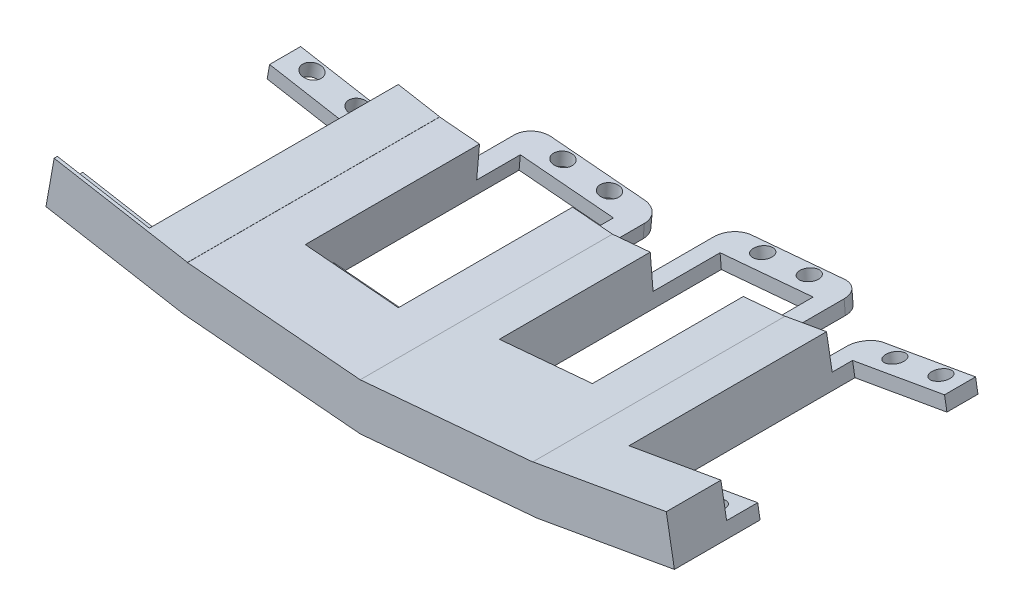
from build123d import *

# Parameters (mm, degrees)
SKETCH10_W               = 70
SKETCH10_H               = 38
BOSS_EXTRUDE6_DEPTH      = 10
SKETCH11_W               = 75
SKETCH11_H               = 38
BOSS_EXTRUDE7_DEPTH      = 10
SKETCH12_W               = 54
SKETCH12_H               = 29
BOSS_EXTRUDE8_DEPTH      = 10
SKETCH13_W               = 65
SKETCH13_H               = 29
BOSS_EXTRUDE9_DEPTH      = 10
SKETCH14_R               = 2
PINKY_HOLE_EXTRUDE_DEPTH = 10
SKETCH14_3_W             = 10
SKETCH14_3_H             = 6.65
SKETCH14_3_R             = 2
SKETCH14_3_W_2           = 20
CUT_EXTRUDE12_DEPTH      = 7
SKETCH16_W               = 10
SKETCH16_H               = 6.65
SKETCH16_R               = 2
RING_HOLE_EXTRUDE_DEPTH  = 7
SKETCH16_3_R             = 2
CUT_EXTRUDE14_DEPTH      = 10
SKETCH17_R               = 2
CUT_EXTRUDE15_DEPTH      = 10
SKETCH18_R               = 2
CUT_EXTRUDE16_DEPTH      = 10
SKETCH18_3_W             = 20
SKETCH18_3_H             = 6.65
SKETCH18_3_R             = 2
CUT_EXTRUDE17_DEPTH      = 7
SKETCH17_3_W             = 20
SKETCH17_3_H             = 6.65
SKETCH17_3_R             = 2
CUT_EXTRUDE18_DEPTH      = 7
CUT_EXTRUDE19_START      = -10
CUT_EXTRUDE19_DEPTH      = 10
CUT_EXTRUDE20_START      = -10
CUT_EXTRUDE20_DEPTH      = 12.565425
CUT_EXTRUDE21_START      = -10
CUT_EXTRUDE21_DEPTH      = 10
SKETCH21_W               = 8.817625364
SKETCH21_H               = 29.329056716
CUT_EXTRUDE22_DEPTH      = 10.038198
BOSS_EXTRUDE10_DEPTH     = 54
SKETCH25_W               = 6.65
SKETCH25_H               = 3
BOSS_EXTRUDE12_DEPTH     = 4
SKETCH26_W               = 6.65
SKETCH26_H               = 3
BOSS_EXTRUDE13_DEPTH     = 4
SKETCH27_W               = 6.65
SKETCH27_H               = 3
BOSS_EXTRUDE14_DEPTH     = 4
SKETCH28_W               = 6.65
SKETCH28_H               = 3
BOSS_EXTRUDE15_DEPTH     = 4
SKETCH29_W               = 6.65
SKETCH29_H               = 3
BOSS_EXTRUDE16_DEPTH     = 4
BOSS_EXTRUDE17_REACH     = 92.923
BOSS_EXTRUDE18_REACH     = 99.642
BOSS_EXTRUDE19_REACH     = 96.21
FILLET1_R                = 4


with BuildPart() as part:
    # Sketch10 → Boss-Extrude6 (new body)
    with BuildSketch(Plane(origin=(0, 0, 0), x_dir=(0, 0, -1), z_dir=(0.08715574274765835, 0.9961946980917455, 0))):
        with Locations((35, 19)):
            Rectangle(SKETCH10_W, SKETCH10_H)
    extrude(amount=BOSS_EXTRUDE6_DEPTH)

    # Sketch11 → Boss-Extrude7 (add)
    with BuildSketch(Plane(origin=(0, 0, 0), x_dir=(0, 0, -1), z_dir=(-0.08715574274765835, 0.9961946980917455, 0))):
        with Locations((37.5, -19)):
            Rectangle(SKETCH11_W, SKETCH11_H)
    extrude(amount=BOSS_EXTRUDE7_DEPTH)

    # Sketch16 → Ring Hole Extrude (cut)
    # profile 1 of 6: a face of its own
    with BuildSketch(Plane(origin=(0.871557427, 9.961946981, 0), x_dir=(0.9961946980917457, -0.08715574274765836, 0), z_dir=(0.08715574274765836, 0.9961946980917457, 0))):
        with BuildLine():
            Line((-19.437443318, 63.35), (-19.437443318, 70))
            Line((-19.437443318, 70), (-24.437443318, 70))
            Line((-24.437443318, 70), (-24.437443318, 69.5))
            ThreePointArc((-24.437443318, 69.5), (-23.023229755, 68.914213562), (-22.437443318, 67.5))
            ThreePointArc((-22.437443318, 67.5), (-24.437443318, 65.5), (-26.437443318, 67.5))
            Line((-26.437443318, 67.5), (-29.437443318, 67.5))
            Line((-29.437443318, 67.5), (-29.437443318, 63.35))
            Line((-29.437443318, 63.35), (-19.437443318, 63.35))
        make_face()
    # profile 2 of 6: a face of its own
    with BuildSketch(Plane(origin=(0.871557427, 9.961946981, 0), x_dir=(0.9961946980917457, -0.08715574274765836, 0), z_dir=(0.08715574274765836, 0.9961946980917457, 0))):
        with BuildLine():
            Line((-24.437443318, 69.5), (-24.437443318, 70))
            Line((-24.437443318, 70), (-29.437443318, 70))
            Line((-29.437443318, 70), (-29.437443318, 67.5))
            Line((-29.437443318, 67.5), (-26.437443318, 67.5))
            ThreePointArc((-26.437443318, 67.5), (-25.85165688, 68.914213562), (-24.437443318, 69.5))
        make_face()
    # profile 3 of 6: a face of its own
    with BuildSketch(Plane(origin=(0.871557427, 9.961946981, 0), x_dir=(0.9961946980917457, -0.08715574274765836, 0), z_dir=(0.08715574274765836, 0.9961946980917457, 0))):
        with BuildLine():
            Line((-14.437443318, 69.5), (-14.437443318, 70))
            Line((-14.437443318, 70), (-19.437443318, 70))
            Line((-19.437443318, 70), (-19.437443318, 63.35))
            Line((-19.437443318, 63.35), (-9.437443318, 63.35))
            Line((-9.437443318, 63.35), (-9.437443318, 67.5))
            Line((-9.437443318, 67.5), (-12.437443318, 67.5))
            ThreePointArc((-12.437443318, 67.5), (-15.85165688, 66.085786438), (-14.437443318, 69.5))
        make_face()
    # profile 4 of 6: a face of its own
    with BuildSketch(Plane(origin=(0.871557427, 9.961946981, 0), x_dir=(0.9961946980917457, -0.08715574274765836, 0), z_dir=(0.08715574274765836, 0.9961946980917457, 0))):
        with BuildLine():
            Line((-9.437443318, 67.5), (-9.437443318, 70))
            Line((-9.437443318, 70), (-14.437443318, 70))
            Line((-14.437443318, 70), (-14.437443318, 69.5))
            ThreePointArc((-14.437443318, 69.5), (-13.023229755, 68.914213562), (-12.437443318, 67.5))
            Line((-12.437443318, 67.5), (-9.437443318, 67.5))
        make_face()
    # profile 5 of 6: a face of its own
    with BuildSketch(Plane(origin=(0.871557427, 9.961946981, 0), x_dir=(0.9961946980917457, -0.08715574274765836, 0), z_dir=(0.08715574274765836, 0.9961946980917457, 0))):
        with Locations((-14.437443318, 20.025)):
            Rectangle(SKETCH16_W, SKETCH16_H)
        with Locations(Location((-14.437443318, 19.2, 0), (0, 0, 180))):
            Circle(SKETCH16_R, mode=Mode.SUBTRACT)
    # profile 6 of 6: a face of its own
    with BuildSketch(Plane(origin=(0.871557427, 9.961946981, 0), x_dir=(0.9961946980917457, -0.08715574274765836, 0), z_dir=(0.08715574274765836, 0.9961946980917457, 0))):
        with Locations((-24.437443318, 20.025)):
            Rectangle(SKETCH16_W, SKETCH16_H)
        with Locations(Location((-24.437443318, 19.2, 0), (0, 0, 180))):
            Circle(SKETCH16_R, mode=Mode.SUBTRACT)
    extrude(amount=-RING_HOLE_EXTRUDE_DEPTH, mode=Mode.SUBTRACT)

    # Sketch16<3> → Cut-Extrude14 (cut)
    with BuildSketch(Plane(origin=(0.871557427, 9.961946981, 0), x_dir=(0.9961946980917457, -0.08715574274765836, 0), z_dir=(0.08715574274765836, 0.9961946980917457, 0))):
        with BuildLine():
            ThreePointArc((-22.437443318, 67.5), (-23.023229755, 68.914213562), (-24.437443318, 69.5))
            Line((-24.437443318, 69.5), (-24.437443318, 67.5))
            Line((-24.437443318, 67.5), (-26.437443318, 67.5))
            ThreePointArc((-26.437443318, 67.5), (-24.437443318, 65.5), (-22.437443318, 67.5))
        make_face()
        with BuildLine():
            Line((-24.437443318, 67.5), (-24.437443318, 69.5))
            ThreePointArc((-24.437443318, 69.5), (-25.85165688, 68.914213562), (-26.437443318, 67.5))
            Line((-26.437443318, 67.5), (-24.437443318, 67.5))
        make_face()
        with BuildLine():
            ThreePointArc((-12.437443318, 67.5), (-13.023229755, 68.914213562), (-14.437443318, 69.5))
            Line((-14.437443318, 69.5), (-14.437443318, 67.5))
            Line((-14.437443318, 67.5), (-12.437443318, 67.5))
        make_face()
        with BuildLine():
            Line((-14.437443318, 67.5), (-14.437443318, 69.5))
            ThreePointArc((-14.437443318, 69.5), (-15.85165688, 66.085786438), (-12.437443318, 67.5))
            Line((-12.437443318, 67.5), (-14.437443318, 67.5))
        make_face()
        with Locations(Location((-24.437443318, 19.2, 0), (0, 0, 180))):
            Circle(SKETCH16_3_R)
        with Locations(Location((-14.437443318, 19.2, 0), (0, 0, 180))):
            Circle(SKETCH16_3_R)
        Polygon((-16.032346576, 43.35), (-19.437443318, 43.35), (-19.437443318, 23.35), (-9.437443318, 23.35), (-9.437443318, 43.35), align=None)
        Polygon((-19.437443318, 23.35), (-19.437443318, 43.35), (-22.842540059, 43.35), (-29.437443318, 43.35), (-29.437443318, 23.35), align=None)
        Polygon((-9.437443318, 54), (-9.437443318, 63.35), (-19.437443318, 63.35), (-19.437443318, 43.35), (-16.032346576, 43.35), (-9.437443318, 43.35), align=None)
        Polygon((-19.437443318, 43.35), (-19.437443318, 63.35), (-29.437443318, 63.35), (-29.437443318, 54), (-29.437443318, 43.35), (-22.842540059, 43.35), align=None)
    extrude(amount=-CUT_EXTRUDE14_DEPTH, mode=Mode.SUBTRACT)

    # Sketch17 → Cut-Extrude15 (cut)
    with BuildSketch(Plane(origin=(-0.871557427, 9.961946981, 0), x_dir=(0.9961946980917457, 0.08715574274765836, 0), z_dir=(-0.08715574274765836, 0.9961946980917457, 0))):
        with BuildLine():
            ThreePointArc((16, 72.5), (15.414213562, 73.914213562), (14, 74.5))
            Line((14, 74.5), (14, 72.5))
            Line((14, 72.5), (12, 72.5))
            ThreePointArc((12, 72.5), (14, 70.5), (16, 72.5))
        make_face()
        with BuildLine():
            Line((14, 72.5), (14, 74.5))
            ThreePointArc((14, 74.5), (12.585786438, 73.914213562), (12, 72.5))
            Line((12, 72.5), (14, 72.5))
        make_face()
        with BuildLine():
            ThreePointArc((26, 72.5), (25.414213562, 73.914213562), (24, 74.5))
            Line((24, 74.5), (24, 72.5))
            Line((24, 72.5), (26, 72.5))
        make_face()
        with BuildLine():
            Line((24, 72.5), (24, 74.5))
            ThreePointArc((24, 74.5), (22.585786438, 71.085786438), (26, 72.5))
            Line((26, 72.5), (24, 72.5))
        make_face()
        with Locations(Location((14, 24.2, 0), (0, 0, 180))):
            Circle(SKETCH17_R)
        with Locations(Location((24, 24.2, 0), (0, 0, 180))):
            Circle(SKETCH17_R)
        Polygon((19, 28.35), (19, 48.35), (15.594903258, 48.35), (9, 48.35), (9, 28.35), align=None)
        Polygon((22.405096742, 48.35), (19, 48.35), (19, 28.35), (29, 28.35), (29, 48.35), align=None)
        Polygon((29, 54), (29, 68.35), (19, 68.35), (19, 48.35), (22.405096742, 48.35), (29, 48.35), align=None)
        Polygon((19, 48.35), (19, 68.35), (9, 68.35), (9, 54), (9, 48.35), (15.594903258, 48.35), align=None)
    extrude(amount=-CUT_EXTRUDE15_DEPTH, mode=Mode.SUBTRACT)

    # Sketch17<3> → Cut-Extrude18 (cut)
    # profile 1 of 2: a face of its own
    with BuildSketch(Plane(origin=(-0.871557427, 9.961946981, 0), x_dir=(0.9961946980917457, 0.08715574274765836, 0), z_dir=(-0.08715574274765836, 0.9961946980917457, 0))):
        with Locations((19, 71.675)):
            Rectangle(SKETCH17_3_W, SKETCH17_3_H)
        with Locations((14, 72.5)):
            Circle(SKETCH17_3_R, mode=Mode.SUBTRACT)
        with Locations((24, 72.5)):
            Circle(SKETCH17_3_R, mode=Mode.SUBTRACT)
    # profile 2 of 2: a face of its own
    with BuildSketch(Plane(origin=(-0.871557427, 9.961946981, 0), x_dir=(0.9961946980917457, 0.08715574274765836, 0), z_dir=(-0.08715574274765836, 0.9961946980917457, 0))):
        with Locations((19, 25.025)):
            Rectangle(SKETCH17_3_W, SKETCH17_3_H)
        with Locations((24, 24.2)):
            Circle(SKETCH17_3_R, mode=Mode.SUBTRACT)
        with Locations((14, 24.2)):
            Circle(SKETCH17_3_R, mode=Mode.SUBTRACT)
    extrude(amount=-CUT_EXTRUDE18_DEPTH, mode=Mode.SUBTRACT)

    # Sketch16<4> → Cut-Extrude19 (cut)
    with BuildSketch(Plane(origin=(0.871557427, 9.961946981, 0), x_dir=(0.9961946980917457, -0.08715574274765836, 0), z_dir=(0.08715574274765836, 0.9961946980917457, 0)).offset(CUT_EXTRUDE19_START)):
        Polygon((-29.437443318, 67.5), (-29.437443318, 70), (-38, 70), (-38, 54), (-29.437443318, 54), (-29.437443318, 63.35), align=None)
        Polygon((-0.874886635, 70), (-9.437443318, 70), (-9.437443318, 67.5), (-9.437443318, 63.35), (-9.437443318, 54), (-0.874886635, 54), align=None)
    extrude(amount=CUT_EXTRUDE19_DEPTH, mode=Mode.SUBTRACT)


with BuildPart() as body_2:
    # Sketch12 → Boss-Extrude8 (new body)
    with BuildSketch(Plane(origin=(-0.575108564, -3.261602745, 0), x_dir=(0, 0, 1), z_dir=(0.1736481776669307, 0.984807753012208, 0))):
        with Locations((-27, -53.226955955)):
            Rectangle(SKETCH12_W, SKETCH12_H)
    extrude(amount=BOSS_EXTRUDE8_DEPTH)

    # Sketch14 → Pinky Hole Extrude (cut)
    with BuildSketch(Plane(origin=(1.161373212, 6.586474785, 0), x_dir=(0.9848077530122081, -0.17364817766693064, 0), z_dir=(0.17364817766693064, 0.9848077530122081, 0))):
        Polygon((-47.726955955, 47.35), (-57.726955955, 47.35), (-67.726955955, 47.35), (-67.726955955, 7.35), (-47.726955955, 7.35), align=None)
        with Locations(Location((-62.726955955, 51.5, 0), (0, 0, 180))):
            Circle(SKETCH14_R)
        with Locations(Location((-52.726955955, 51.5, 0), (0, 0, 180))):
            Circle(SKETCH14_R)
        with Locations(Location((-52.726955955, 3.2, 0), (0, 0, 180))):
            Circle(SKETCH14_R)
        with Locations(Location((-62.726955955, 3.2, 0), (0, 0, 180))):
            Circle(SKETCH14_R)
    extrude(amount=-PINKY_HOLE_EXTRUDE_DEPTH, mode=Mode.SUBTRACT)

    # Sketch14<3> → Cut-Extrude12 (cut)
    # profile 1 of 4: a face of its own
    with BuildSketch(Plane(origin=(1.161373212, 6.586474785, 0), x_dir=(0.9848077530122081, -0.17364817766693064, 0), z_dir=(0.17364817766693064, 0.9848077530122081, 0))):
        with BuildLine():
            Line((-57.726955955, 47.35), (-57.726955955, 54))
            Line((-57.726955955, 54), (-62.726955955, 54))
            Line((-62.726955955, 54), (-62.726955955, 53.5))
            ThreePointArc((-62.726955955, 53.5), (-61.312742393, 52.914213562), (-60.726955955, 51.5))
            ThreePointArc((-60.726955955, 51.5), (-62.726955955, 49.5), (-64.726955955, 51.5))
            Line((-64.726955955, 51.5), (-67.726955955, 51.5))
            Line((-67.726955955, 51.5), (-67.726955955, 47.35))
            Line((-67.726955955, 47.35), (-57.726955955, 47.35))
        make_face()
    # profile 2 of 4: a face of its own
    with BuildSketch(Plane(origin=(1.161373212, 6.586474785, 0), x_dir=(0.9848077530122081, -0.17364817766693064, 0), z_dir=(0.17364817766693064, 0.9848077530122081, 0))):
        with BuildLine():
            Line((-62.726955955, 53.5), (-62.726955955, 54))
            Line((-62.726955955, 54), (-67.726955955, 54))
            Line((-67.726955955, 54), (-67.726955955, 51.5))
            Line((-67.726955955, 51.5), (-64.726955955, 51.5))
            ThreePointArc((-64.726955955, 51.5), (-64.141169517, 52.914213562), (-62.726955955, 53.5))
        make_face()
    # profile 3 of 4: a face of its own
    with BuildSketch(Plane(origin=(1.161373212, 6.586474785, 0), x_dir=(0.9848077530122081, -0.17364817766693064, 0), z_dir=(0.17364817766693064, 0.9848077530122081, 0))):
        with Locations((-52.726955955, 50.675)):
            Rectangle(SKETCH14_3_W, SKETCH14_3_H)
        with Locations(Location((-52.726955955, 51.5, 0), (0, 0, 180))):
            Circle(SKETCH14_3_R, mode=Mode.SUBTRACT)
    # profile 4 of 4: a face of its own
    with BuildSketch(Plane(origin=(1.161373212, 6.586474785, 0), x_dir=(0.9848077530122081, -0.17364817766693064, 0), z_dir=(0.17364817766693064, 0.9848077530122081, 0))):
        with Locations((-57.726955955, 4.025)):
            Rectangle(SKETCH14_3_W_2, SKETCH14_3_H)
        with Locations(Location((-62.726955955, 3.2, 0), (0, 0, 180))):
            Circle(SKETCH14_3_R, mode=Mode.SUBTRACT)
        with Locations(Location((-52.726955955, 3.2, 0), (0, 0, 180))):
            Circle(SKETCH14_3_R, mode=Mode.SUBTRACT)
    extrude(amount=-CUT_EXTRUDE12_DEPTH, mode=Mode.SUBTRACT)



with BuildPart() as body_3:
    # Sketch13 → Boss-Extrude9 (new body)
    with BuildSketch(Plane(origin=(0.575108564, -3.261602745, 0), x_dir=(0, 0, -1), z_dir=(-0.1736481776669307, 0.984807753012208, 0))):
        with Locations((32.5, -53.226955955)):
            Rectangle(SKETCH13_W, SKETCH13_H)
    extrude(amount=BOSS_EXTRUDE9_DEPTH)

    # Sketch18 → Cut-Extrude16 (cut)
    with BuildSketch(Plane(origin=(-1.161373212, 6.586474785, 0), x_dir=(0.984807753012208, 0.17364817766693064, 0), z_dir=(-0.17364817766693064, 0.984807753012208, 0))):
        with BuildLine():
            ThreePointArc((54.726955955, 62.5), (54.141169517, 63.914213562), (52.726955955, 64.5))
            Line((52.726955955, 64.5), (52.726955955, 62.5))
            Line((52.726955955, 62.5), (50.726955955, 62.5))
            ThreePointArc((50.726955955, 62.5), (52.726955955, 60.5), (54.726955955, 62.5))
        make_face()
        with BuildLine():
            Line((52.726955955, 62.5), (52.726955955, 64.5))
            ThreePointArc((52.726955955, 64.5), (51.312742393, 63.914213562), (50.726955955, 62.5))
            Line((50.726955955, 62.5), (52.726955955, 62.5))
        make_face()
        with BuildLine():
            ThreePointArc((64.726955955, 62.5), (64.141169517, 63.914213562), (62.726955955, 64.5))
            Line((62.726955955, 64.5), (62.726955955, 62.5))
            Line((62.726955955, 62.5), (64.726955955, 62.5))
        make_face()
        with BuildLine():
            Line((62.726955955, 62.5), (62.726955955, 64.5))
            ThreePointArc((62.726955955, 64.5), (61.312742393, 61.085786438), (64.726955955, 62.5))
            Line((64.726955955, 62.5), (62.726955955, 62.5))
        make_face()
        with Locations(Location((62.726955955, 14.2, 0), (0, 0, 180))):
            Circle(SKETCH18_R)
        with Locations(Location((52.726955955, 14.2, 0), (0, 0, 180))):
            Circle(SKETCH18_R)
        Polygon((67.726955955, 38.35), (67.726955955, 58.35), (57.726955955, 58.35), (57.726955955, 38.35), (61.132052697, 38.35), align=None)
        Polygon((57.726955955, 38.35), (57.726955955, 58.35), (47.726955955, 58.35), (47.726955955, 54), (47.726955955, 38.35), (54.321859213, 38.35), align=None)
        Polygon((57.726955955, 18.35), (57.726955955, 38.35), (54.321859213, 38.35), (47.726955955, 38.35), (47.726955955, 18.35), align=None)
        Polygon((67.726955955, 18.35), (67.726955955, 38.35), (61.132052697, 38.35), (57.726955955, 38.35), (57.726955955, 18.35), align=None)
    extrude(amount=-CUT_EXTRUDE16_DEPTH, mode=Mode.SUBTRACT)

    # Sketch18<3> → Cut-Extrude17 (cut)
    # profile 1 of 2: a face of its own
    with BuildSketch(Plane(origin=(-1.161373212, 6.586474785, 0), x_dir=(0.984807753012208, 0.17364817766693064, 0), z_dir=(-0.17364817766693064, 0.984807753012208, 0))):
        with Locations((57.726955955, 61.675)):
            Rectangle(SKETCH18_3_W, SKETCH18_3_H)
        with Locations((52.726955955, 62.5)):
            Circle(SKETCH18_3_R, mode=Mode.SUBTRACT)
        with Locations((62.726955955, 62.5)):
            Circle(SKETCH18_3_R, mode=Mode.SUBTRACT)
    # profile 2 of 2: a face of its own
    with BuildSketch(Plane(origin=(-1.161373212, 6.586474785, 0), x_dir=(0.984807753012208, 0.17364817766693064, 0), z_dir=(-0.17364817766693064, 0.984807753012208, 0))):
        with Locations((57.726955955, 15.025)):
            Rectangle(SKETCH18_3_W, SKETCH18_3_H)
        with Locations((62.726955955, 14.2)):
            Circle(SKETCH18_3_R, mode=Mode.SUBTRACT)
        with Locations((52.726955955, 14.2)):
            Circle(SKETCH18_3_R, mode=Mode.SUBTRACT)
    extrude(amount=-CUT_EXTRUDE17_DEPTH, mode=Mode.SUBTRACT)

    # Sketch18<4> → Cut-Extrude21 (cut)
    with BuildSketch(Plane(origin=(-1.161373212, 6.586474785, 0), x_dir=(0.984807753012208, 0.17364817766693064, 0), z_dir=(-0.17364817766693064, 0.984807753012208, 0)).offset(CUT_EXTRUDE21_START)):
        Polygon((47.726955955, 62.5), (47.726955955, 65), (38.726955955, 65), (38.726955955, 54), (47.726955955, 54), (47.726955955, 58.35), align=None)
    extrude(amount=CUT_EXTRUDE21_DEPTH, mode=Mode.SUBTRACT)


with BuildPart() as cut_extrude19_piece_1:
    # of the separate pieces the step leaves, piece 1, a body of its own (cut_extrude19_pieces)
    add(part.part.solids().sort_by_distance((37.855398527, 3.311918224, 0))[0])

    # Sketch17<4> → Cut-Extrude20 (cut)
    with BuildSketch(Plane(origin=(-0.871557427, 9.961946981, 0), x_dir=(0.9961946980917457, 0.08715574274765836, 0), z_dir=(-0.08715574274765836, 0.9961946980917457, 0)).offset(CUT_EXTRUDE20_START)):
        Polygon((9, 72.5), (9, 75), (0, 75), (0, 70), (0.874886635, 70), (0.874886635, 54), (9, 54), (9, 68.35), align=None)
        Polygon((38, 75), (29, 75), (29, 72.5), (29, 68.35), (29, 54), (38, 54), align=None)
    extrude(amount=CUT_EXTRUDE20_DEPTH, mode=Mode.SUBTRACT)


with BuildPart() as cut_extrude19_piece_2:
    # of the separate pieces the step leaves, piece 2, a body of its own (cut_extrude19_pieces)
    add(part.part.solids().sort_by_distance((-9.401530997, 0.822527382, -70))[0])

    # Sketch28 → Boss-Extrude15 (add)
    with BuildSketch(Plane(origin=(-9.401530997, 0.822527382, 0), x_dir=(0, 0, -1), z_dir=(0.9961946980917457, -0.08715574274765837, 2.8254721722816123e-15))):
        with Locations((66.675, 1.5)):
            Rectangle(SKETCH28_W, SKETCH28_H)
    extrude(amount=BOSS_EXTRUDE15_DEPTH)

    # Sketch29 → Boss-Extrude16 (add)
    with BuildSketch(Plane(origin=(-29.325424958, 2.565642237, 0), x_dir=(0, 0, 1), z_dir=(-0.9961946980917457, 0.08715574274765837, 0))):
        with Locations((-66.675, 1.5)):
            Rectangle(SKETCH29_W, SKETCH29_H)
    extrude(amount=BOSS_EXTRUDE16_DEPTH)


with BuildPart() as cut_extrude20_piece_1:
    # of the separate pieces the step leaves, piece 1, a body of its own (cut_extrude20_pieces)
    add(cut_extrude19_piece_1.part.solids().sort_by_distance((37.855398527, 3.311918224, 0))[0])

    # Sketch21 → Cut-Extrude22 (cut)
    with BuildSketch(Plane(origin=(0, 0, 0), x_dir=(1, 0, 0), z_dir=(0, 1, 0))):
        with Locations((0.143825897, 68.664528358)):
            Rectangle(SKETCH21_W, SKETCH21_H)
    extrude(amount=CUT_EXTRUDE22_DEPTH, mode=Mode.SUBTRACT)


with BuildPart() as cut_extrude20_piece_2:
    # of the separate pieces the step leaves, piece 2, a body of its own (cut_extrude20_pieces)
    add(cut_extrude19_piece_1.part.solids().sort_by_distance((8.965752283, 0.784401685, -68.35))[0])

    # Sketch26 → Boss-Extrude13 (add)
    with BuildSketch(Plane(origin=(28.889646245, 2.52751654, 0), x_dir=(0, 0, -1), z_dir=(0.9961946980917457, 0.08715574274765836, 0))):
        with Locations((71.675, 1.5)):
            Rectangle(SKETCH26_W, SKETCH26_H)
    extrude(amount=BOSS_EXTRUDE13_DEPTH)

    # Sketch27 → Boss-Extrude14 (add)
    with BuildSketch(Plane(origin=(8.965752283, 0.784401685, 0), x_dir=(0, 0, 1), z_dir=(-0.9961946980917457, -0.08715574274765836, 0))):
        with Locations((-71.675, 1.5)):
            Rectangle(SKETCH27_W, SKETCH27_H)
    extrude(amount=BOSS_EXTRUDE14_DEPTH)


with BuildPart() as cut_extrude21_piece_1:
    # of the separate pieces the step leaves, piece 1, a body of its own (cut_extrude21_pieces)
    add(body_3.part.solids().sort_by_distance((67.273139877, 8.499059736, 0))[0])


with BuildPart() as cut_extrude21_piece_2:
    # of the separate pieces the step leaves, piece 2, a body of its own (cut_extrude21_pieces)
    add(body_3.part.solids().sort_by_distance((47.576984816, 5.026096182, -65))[0])

    # Sketch25 → Boss-Extrude12 (add)
    with BuildSketch(Plane(origin=(47.001876252, 8.287698927, 0), x_dir=(0, 0, 1), z_dir=(-0.9848077530122081, -0.17364817766693064, 0))):
        with Locations((-61.675, -1.811918224)):
            Rectangle(SKETCH25_W, SKETCH25_H)
    extrude(amount=BOSS_EXTRUDE12_DEPTH)


with BuildPart() as body_2_1:
    add(body_2.part)

    add(cut_extrude20_piece_1.part)  # Boss-Extrude10 merges Cut-Extrude20 piece 1

    add(cut_extrude21_piece_1.part)  # Boss-Extrude10 merges Cut-Extrude21 piece 1
    # Sketch22 → Boss-Extrude10 (add)
    with BuildSketch(Plane(origin=(0, 0, -54), x_dir=(-1, 0, 0), z_dir=(0, 0, -1))):
        Polygon((38.713715039, 3.463262583), (37.855398527, 3.311918224), (36.9838411, 13.273865205), align=None)
        Polygon((-38.713715039, 3.463262583), (-36.9838411, 13.273865205), (-37.855398527, 3.311918224), align=None)
    extrude(amount=-BOSS_EXTRUDE10_DEPTH)

    # Sketch30 → Boss-Extrude17 (add, up to next)
    with BuildSketch(Plane.XY.offset(-58.35), mode=Mode.PRIVATE) as boss_extrude17_sk1:
        Polygon((43.116809271, 7.285926731), (43.637753804, 4.331503472), (47.576984816, 5.026096182), (47.056040283, 7.980519441), align=None)
    boss_extrude17_tool1 = extrude(boss_extrude17_sk1.sketch, amount=BOSS_EXTRUDE17_REACH, mode=Mode.PRIVATE) - body_2_1.part

    add(cut_extrude21_piece_2.part)  # Boss-Extrude17 merges Cut-Extrude21 piece 2
    add(boss_extrude17_tool1.solids().sort_by_distance((45.346897, 6.156011, -58.35))[0])

    # Sketch31 → Boss-Extrude18 (add, up to next)
    with BuildSketch(Plane.XY.offset(-68.35), mode=Mode.PRIVATE) as boss_extrude18_sk1:
        Polygon((4.719506262, 3.424362808), (4.98097349, 0.435778714), (8.965752283, 0.784401685), (8.704285055, 3.772985779), align=None)
    boss_extrude18_tool1 = extrude(boss_extrude18_sk1.sketch, amount=BOSS_EXTRUDE18_REACH, mode=Mode.PRIVATE) - body_2_1.part
    # Sketch31 → Boss-Extrude18 (add, up to next)
    with BuildSketch(Plane.XY.offset(-68.35), mode=Mode.PRIVATE) as boss_extrude18_sk2:
        Polygon((32.612957809, 5.864723605), (32.874425037, 2.876139511), (28.889646245, 2.52751654), (28.628179016, 5.516100634), align=None)
    boss_extrude18_tool2 = extrude(boss_extrude18_sk2.sketch, amount=BOSS_EXTRUDE18_REACH, mode=Mode.PRIVATE) - body_2_1.part

    add(cut_extrude20_piece_2.part)  # Boss-Extrude18 merges Cut-Extrude20 piece 2
    add(boss_extrude18_tool1.solids().sort_by_distance((6.842629, 2.104382, -68.35))[0])
    add(boss_extrude18_tool2.solids().sort_by_distance((30.751302, 4.19612, -68.35))[0])

    # Sketch32 → Boss-Extrude19 (add, up to next)
    with BuildSketch(Plane.XY.offset(-63.35), mode=Mode.PRIVATE) as boss_extrude19_sk1:
        Polygon((-33.048736523, 5.902849302), (-33.310203751, 2.914265208), (-29.325424958, 2.565642237), (-29.06395773, 5.554226331), align=None)
    boss_extrude19_tool1 = extrude(boss_extrude19_sk1.sketch, amount=BOSS_EXTRUDE19_REACH, mode=Mode.PRIVATE) - body_2_1.part
    # Sketch32 → Boss-Extrude19 (add, up to next)
    with BuildSketch(Plane.XY.offset(-63.35), mode=Mode.PRIVATE) as boss_extrude19_sk2:
        Polygon((-5.155284976, 3.462488505), (-5.416752204, 0.473904411), (-9.401530997, 0.822527382), (-9.140063768, 3.811111476), align=None)
    boss_extrude19_tool2 = extrude(boss_extrude19_sk2.sketch, amount=BOSS_EXTRUDE19_REACH, mode=Mode.PRIVATE) - body_2_1.part

    add(cut_extrude19_piece_2.part)  # Boss-Extrude19 merges Cut-Extrude19 piece 2
    add(boss_extrude19_tool1.solids().sort_by_distance((-31.187081, 4.234246, -63.35))[0])
    add(boss_extrude19_tool2.solids().sort_by_distance((-7.278408, 2.142508, -63.35))[0])

    # Fillet1
    fillet1_edges = [body_2_1.edges().sort_by_distance(p)[0] for p in [
        (-5.28601859, 1.968196458, -70),
        (-33.179470137, 4.408557255, -70),
        (32.743691423, 4.370431558, -75),
        (4.850239876, 1.930070761, -75),
        (43.377281538, 5.808715101, -65),
    ]]
    fillet(fillet1_edges, radius=FILLET1_R)


solid = body_2_1.part
